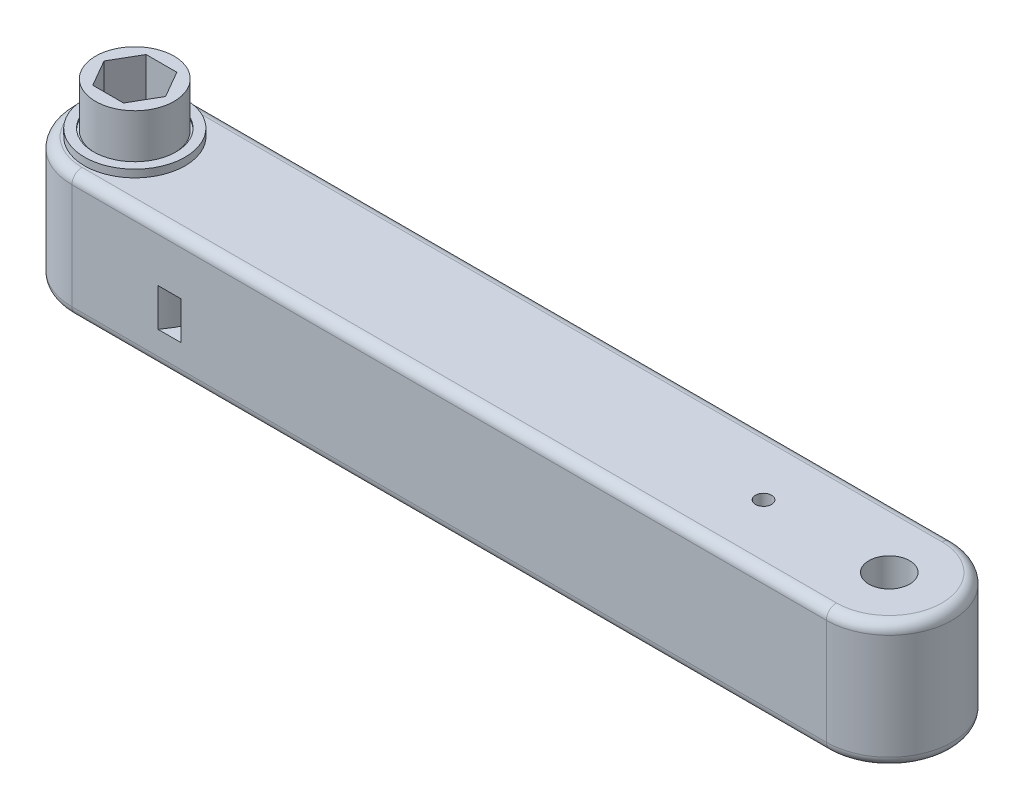
from build123d import *

# Parameters (mm, degrees)
SALIENTE_EXTRUIR1_DEPTH    = 25
CROQUIS5_R                 = 4.05
CROQUIS5_R_2               = 1.6
CORTAR_EXTRUIR1_DEPTH      = 51.5
REDONDEO2_R                = 2
CORTAR_EXTRUIR2_REACH      = 168.696
CORTAR_EXTRUIR4_DEPTH      = 1
CORTAR_EXTRUIR4_DEPTH_BACK = 167.695830887
CROQUIS13_W                = 3.831890827
CROQUIS13_H                = 7.53605196


with BuildPart() as part:
    # Croquis2 → Saliente-Extruir1 (new body)
    with BuildSketch(Plane(origin=(0, 0, 0), x_dir=(1, 0, 0), z_dir=(0, 1, 0))):
        with BuildLine():
            Line((0, -12.5), (150, -12.5))
            ThreePointArc((150, -12.5), (162.5, 0), (150, 12.5))
            Line((150, 12.5), (0, 12.5))
            ThreePointArc((0, 12.5), (-12.5, 0), (0, -12.5))
        make_face()
    extrude(amount=SALIENTE_EXTRUIR1_DEPTH)

    # Croquis5 → Cortar-Extruir1 (cut)
    with BuildSketch(Plane(origin=(0, 25, 0), x_dir=(1, 0, 0), z_dir=(0, 1, 0))):
        with Locations((150, 0)):
            Circle(CROQUIS5_R)
        with Locations((125, 0)):
            Circle(CROQUIS5_R_2)
    extrude(amount=-CORTAR_EXTRUIR1_DEPTH, mode=Mode.SUBTRACT)

    # Croquis9 → Revolución2 (revolve)
    with BuildSketch(Plane.XY):
        Polygon((0, 25), (0, 35), (7.8, 35), (7.8, 26.5), (7.8, 26.1), (8.2, 26.1), (8.2, 26.5), (10, 26.5), (10, 25), align=None)
    revolve(axis=Axis((0, 25, 0), (0, 1, 0)))

    # Croquis1 → Cortar-Revolución1 (revolve, cut)
    with BuildSketch(Plane.XY):
        Polygon((9.3, 17), (1, 20), (1, 0), (9.3, 0), (9.3, 7.5), (7.3, 8.654700538), (7.3, 12.7), (9.3, 12.7), align=None)
    revolve(axis=Axis((1, 20, 0), (0, -1, 0)), mode=Mode.SUBTRACT)

    # Redondeo2
    redondeo2_edges = [part.edges().sort_by_distance(p)[0] for p in [
        (-12.5, 0, 0),
        (75, 0, -12.5),
        (162.5, 0, 0),
        (-12.5, 25, 0),
        (75, 25, -12.5),
        (162.5, 25, 0),
        (75, 0, 12.5),
        (75, 25, 12.5),
    ]]
    fillet(redondeo2_edges, radius=REDONDEO2_R)

    # Croquis10 → Cortar-Extruir2 (cut, up to next)
    with BuildSketch(Plane(origin=(0, 35, 0), x_dir=(1, 0, 0), z_dir=(0, 1, 0)), mode=Mode.PRIVATE) as cortar_extruir2_sk1:
        Polygon((6.119912853, 0), (3.059956427, 5.3), (-3.059956427, 5.3), (-6.119912853, 0), (-3.059956427, -5.3), (3.059956427, -5.3), align=None)
    cortar_extruir2_tool1 = extrude(cortar_extruir2_sk1.sketch, amount=-CORTAR_EXTRUIR2_REACH, mode=Mode.PRIVATE) & part.part
    add(cortar_extruir2_tool1.solids().sort_by_distance((0, 35, 0))[0], mode=Mode.SUBTRACT)

    # Croquis12 → Cortar-Extruir4 (cut, two sides: drawn at the far end of the back side and taken through both)
    with BuildSketch(Plane(origin=(0, 0, 0), x_dir=(0, 0, -1), z_dir=(1, 0, 0)).offset(-CORTAR_EXTRUIR4_DEPTH_BACK)):
        Polygon((8.3, 7.5), (6.3, 8.654700538), (6.3, 12.7), (8.3, 12.7), (8.3, 17), (0, 20), (-8.3, 17), (-8.3, 12.7), (-6.3, 12.7), (-6.3, 8.654700538), (-8.3, 7.5), (-8.3, 0), (8.3, 0), align=None)
    extrude(amount=CORTAR_EXTRUIR4_DEPTH + CORTAR_EXTRUIR4_DEPTH_BACK, mode=Mode.SUBTRACT)

    # Croquis13 → Cortar-Revolución2 (revolve, cut)
    with BuildSketch(Plane.XY):
        with Locations((23.136343839, 10.430899618)):
            Rectangle(CROQUIS13_W, CROQUIS13_H)
    revolve(axis=Axis((0, 0, 0), (0, 1, 0)), mode=Mode.SUBTRACT)


solid = part.part
